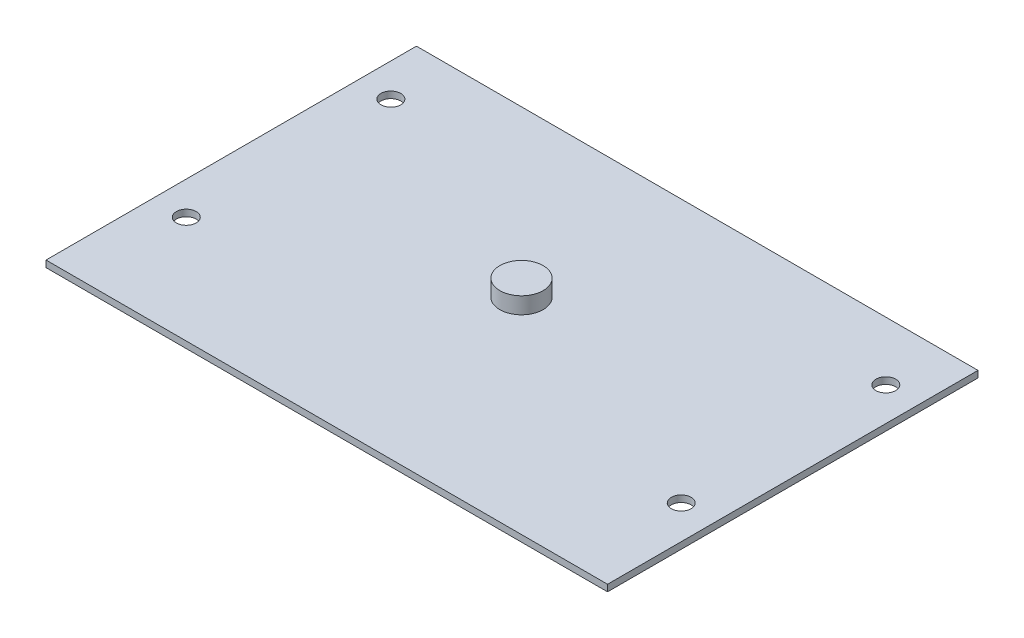
from build123d import *

# Parameters (mm, degrees)
SKETCH1_W           = 85.09
SKETCH1_H           = 56.134
SKETCH1_R           = 1.5
BOSS_EXTRUDE1_DEPTH = 1
SKETCH2_R           = 3.283223987
BOSS_EXTRUDE2_DEPTH = 2.5


with BuildPart() as part:
    # Sketch1 → Boss-Extrude1 (new body)
    with BuildSketch(Plane(origin=(0, 0, 0), x_dir=(1, 0, 0), z_dir=(0, 1, 0))):
        with Locations((42.545, 28.067)):
            Rectangle(SKETCH1_W, SKETCH1_H)
        with Locations(Location((5.01, 47.244, 0), (0, 0, 270))):
            Circle(SKETCH1_R, mode=Mode.SUBTRACT)
        with Locations(Location((80.01, 47.244, 0), (0, 0, 270))):
            Circle(SKETCH1_R, mode=Mode.SUBTRACT)
        with Locations(Location((5.01, 16.244, 0), (0, 0, 270))):
            Circle(SKETCH1_R, mode=Mode.SUBTRACT)
        with Locations(Location((80.01, 16.244, 0), (0, 0, 270))):
            Circle(SKETCH1_R, mode=Mode.SUBTRACT)
    extrude(amount=BOSS_EXTRUDE1_DEPTH)

    # Sketch2 → Boss-Extrude2 (add)
    with BuildSketch(Plane(origin=(0, 1, 0), x_dir=(1, 0, 0), z_dir=(0, 1, 0))):
        with Locations(Location((40.898145706, 31.154537448, 0), (0, 0, 90))):
            Circle(SKETCH2_R)
    extrude(amount=BOSS_EXTRUDE2_DEPTH)


solid = part.part
